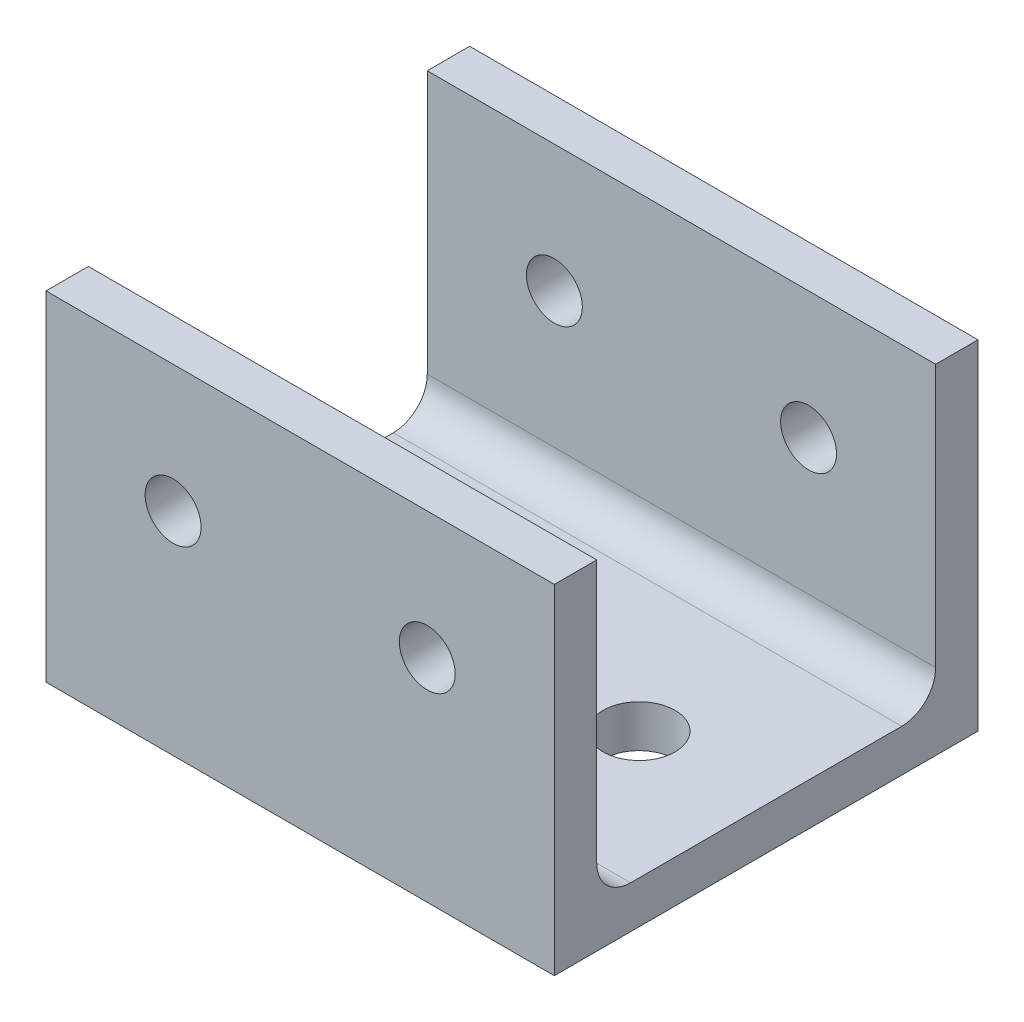
from build123d import *

# Parameters (mm, degrees)
EXTRUDE_1_DEPTH     = 60
SKETCH_2_R          = 4.25
CUT_EXTRUDE_1_DEPTH = 88.749643874
SKETCH_3_R          = 3.3
CUT_EXTRUDE_2_DEPTH = 88.749643874
FILLET_1_R          = 4


with BuildPart() as part:
    # 草圖1 → 填料-伸長1 (new body)
    with BuildSketch(Plane(origin=(0, 0, 0), x_dir=(0, 0, -1), z_dir=(1, 0, 0))):
        Polygon((0, 0), (50, 0), (50, 40), (45, 40), (45, 5), (5, 5), (5, 40), (0, 40), align=None)
    extrude(amount=EXTRUDE_1_DEPTH)

    # 草圖2 → 除料-伸長1 (cut, through all)
    with BuildSketch(Plane(origin=(0, 0, 0), x_dir=(1, 0, 0), z_dir=(0, 1, 0))):
        with Locations(Location((15, 25, 0), (0, 0, 90))):
            Circle(SKETCH_2_R)
        with Locations(Location((45, 25, 0), (0, 0, 90))):
            Circle(SKETCH_2_R)
    extrude(amount=CUT_EXTRUDE_1_DEPTH, mode=Mode.SUBTRACT)

    # 草圖3 → 除料-伸長2 (cut, through all)
    with BuildSketch(Plane.XY):
        with Locations((15, 25)):
            Circle(SKETCH_3_R)
        with Locations((45, 25)):
            Circle(SKETCH_3_R)
    extrude(amount=-CUT_EXTRUDE_2_DEPTH, mode=Mode.SUBTRACT)

    # 圓角1
    fillet_1_edges = [part.edges().sort_by_distance(p)[0] for p in [
        (30, 5, -5),
        (30, 5, -45),
    ]]
    fillet(fillet_1_edges, radius=FILLET_1_R)


solid = part.part
